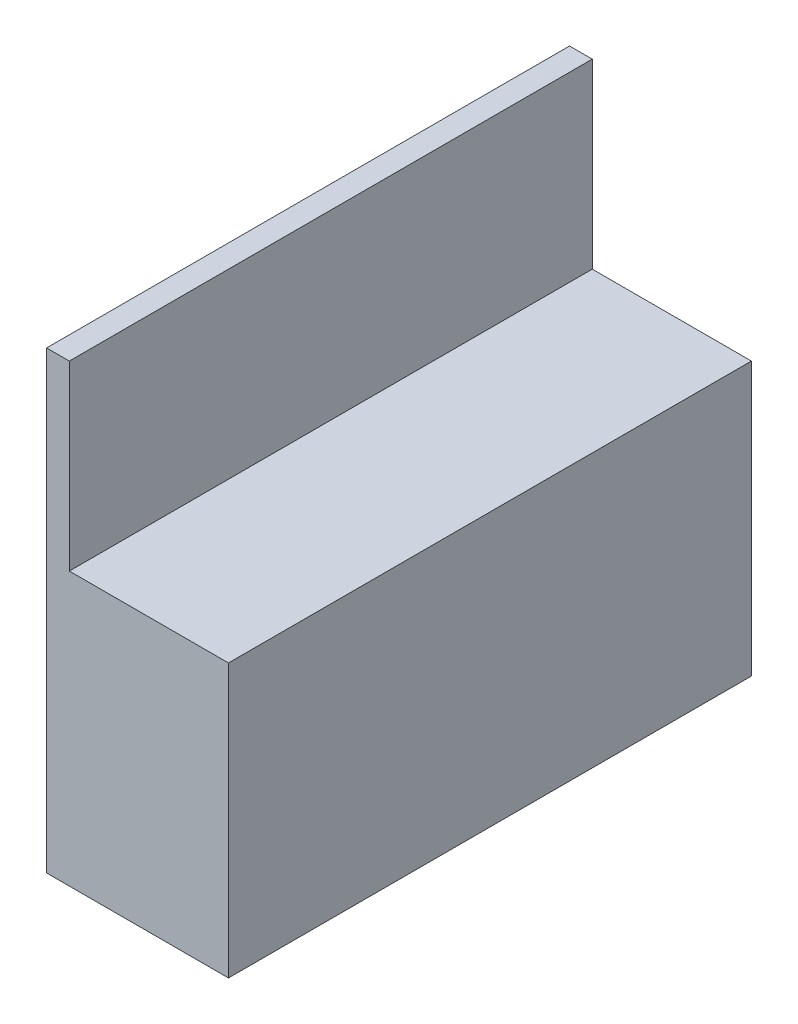
from build123d import *

# Parameters (mm, degrees)
BOSS_EXTRUDE1_DEPTH = 115


with BuildPart() as part:
    # Sketch1 → Boss-Extrude1 (new body)
    with BuildSketch(Plane.XY):
        Polygon((0, 0), (0, 40), (-5, 40), (-5, -60), (35, -60), (35, 0), align=None)
    extrude(amount=BOSS_EXTRUDE1_DEPTH)


solid = part.part
